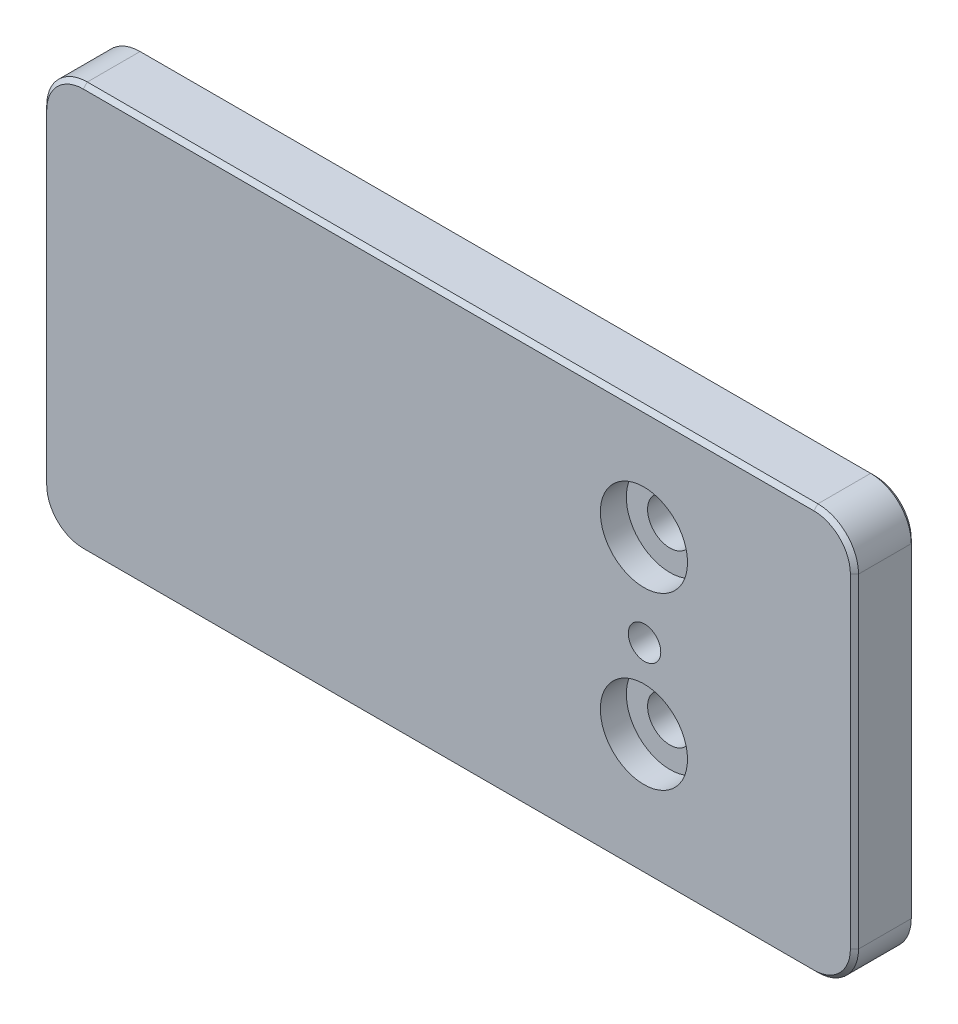
from build123d import *

# Parameters (mm, degrees)
SKETCH1_W                                = 200
SKETCH1_H                                = 100
BOSS_EXTRUDE1_DEPTH                      = 15
FILLET1_R                                = 10
CBORE_FOR_M10_HEX_HEAD_BOLT1_D           = 11
CBORE_FOR_M10_HEX_HEAD_BOLT1_CBORE_D     = 21.475
CBORE_FOR_M10_HEX_HEAD_BOLT1_CBORE_DEPTH = 6.4
F_8_0MM_DOWEL_HOLE1_D                    = 8
CHAMFER1_SIZE                            = 1


with BuildPart() as part:
    # Sketch1 → Boss-Extrude1 (new body)
    with BuildSketch(Plane.XY):
        Rectangle(SKETCH1_W, SKETCH1_H)
    extrude(amount=BOSS_EXTRUDE1_DEPTH)

    # Fillet1
    fillet1_edges = [part.edges().sort_by_distance(p)[0] for p in [
        (100, -50, 7.5),
        (-100, -50, 7.5),
        (-100, 50, 7.5),
        (100, 50, 7.5),
    ]]
    fillet(fillet1_edges, radius=FILLET1_R)

    # CBORE for M10 Hex Head Bolt1 (through all)
    with Locations(Plane.XY.offset(15)):
        with Locations((48.132684833, 22.427148815), (48.132684833, -19.595814413)):
            CounterBoreHole(CBORE_FOR_M10_HEX_HEAD_BOLT1_D / 2, CBORE_FOR_M10_HEX_HEAD_BOLT1_CBORE_D / 2, CBORE_FOR_M10_HEX_HEAD_BOLT1_CBORE_DEPTH)

    # Ø8.0mm Dowel Hole1 (through all)
    with Locations(Plane.XY.offset(15)):
        with Locations((48.281702433, 0)):
            Hole(F_8_0MM_DOWEL_HOLE1_D / 2)

    # Chamfer1
    chamfer1_edges = [part.edges().sort_by_distance(p)[0] for p in [
        (0, 50, 0),
        (0, 50, 15),
        (100, 0, 0),
        (0, -50, 0),
        (-100, 0, 0),
        (-97.071067812, -47.071067812, 0),
        (-97.071067812, 47.071067812, 0),
        (97.071067812, -47.071067812, 0),
        (97.071067812, 47.071067812, 0),
        (100, 0, 15),
        (-100, 0, 15),
        (0, -50, 15),
        (-97.071067812, -47.071067812, 15),
        (-97.071067812, 47.071067812, 15),
        (97.071067812, -47.071067812, 15),
        (97.071067812, 47.071067812, 15),
    ]]
    chamfer(chamfer1_edges, length=CHAMFER1_SIZE)


solid = part.part
